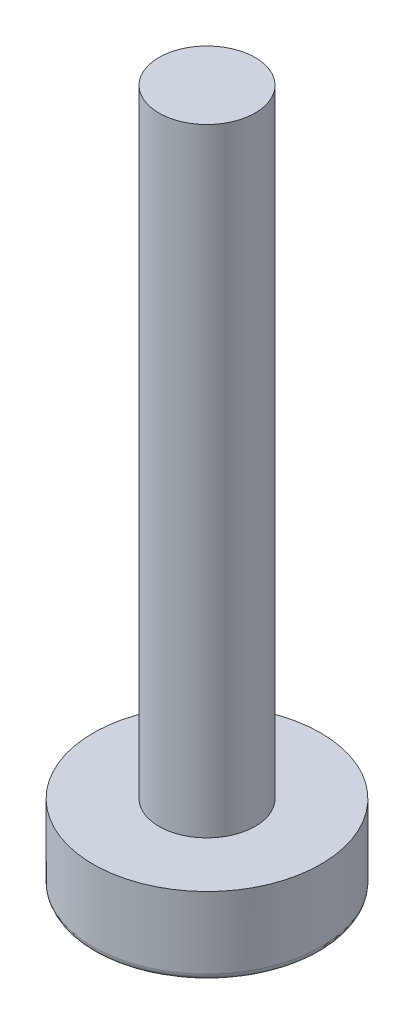
from build123d import *

# Parameters (mm, degrees)
SKETCH1_R           = 4.445
BOSS_EXTRUDE1_DEPTH = 3.048
SKETCH2_R           = 1.8796
BOSS_EXTRUDE2_DEPTH = 24.13
FILLET1_R           = 0.254


with BuildPart() as part:
    # Sketch1 → Boss-Extrude1 (new body)
    with BuildSketch(Plane(origin=(0, 0, 0), x_dir=(1, 0, 0), z_dir=(0, 1, 0))):
        with Locations(Location((0, 0, 0), (0, 0, 90))):
            Circle(SKETCH1_R)
    extrude(amount=BOSS_EXTRUDE1_DEPTH)

    # Sketch2 → Boss-Extrude2 (add)
    with BuildSketch(Plane(origin=(0, 3.048, 0), x_dir=(1, 0, 0), z_dir=(0, 1, 0))):
        with Locations(Location((0, 0, 0), (0, 0, 90))):
            Circle(SKETCH2_R)
    extrude(amount=BOSS_EXTRUDE2_DEPTH)

    # Fillet1
    fillet1_edges = [part.edges().sort_by_distance(p)[0] for p in [
        (0, 0, 4.445),
    ]]
    fillet(fillet1_edges, radius=FILLET1_R)


solid = part.part
